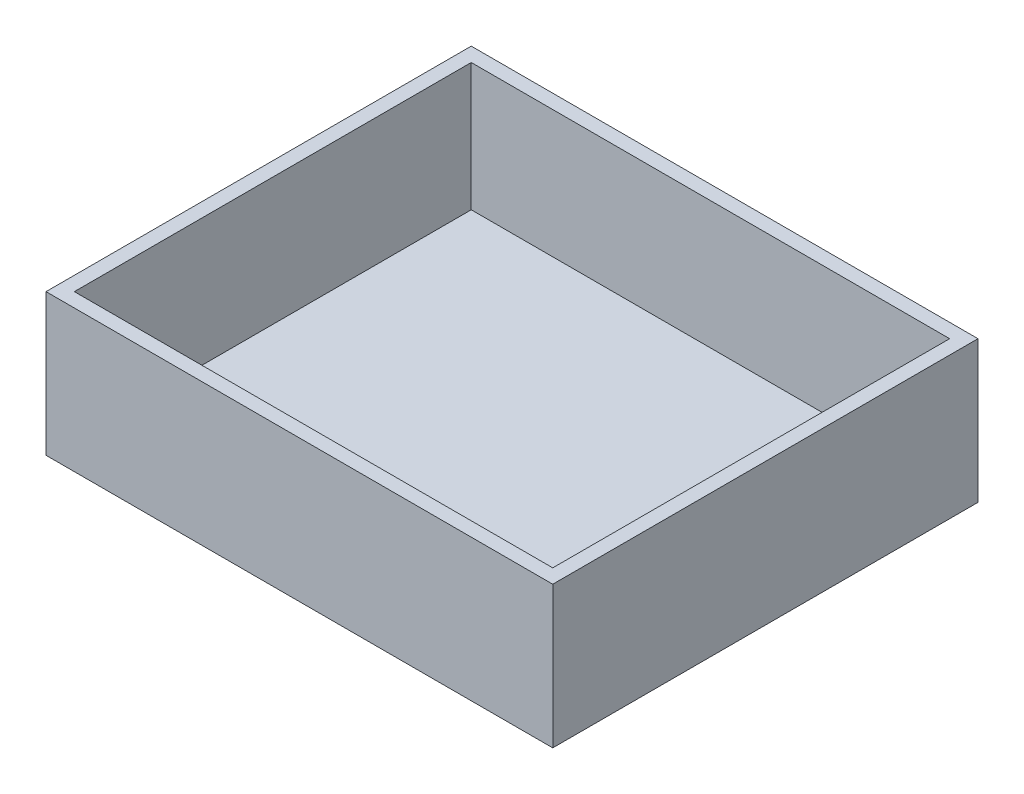
from build123d import *

# Parameters (mm, degrees)
CROQUIS1_W              = 71.5
CROQUIS1_H              = 60
SALIENTE_EXTRUIR1_DEPTH = 20
VACIADO1_T              = -2
CROQUIS3_W              = 32.700305435
CROQUIS3_H              = 4.402483211
CROQUIS3_W_2            = 29.112946205
CROQUIS3_H_2            = 4.942332104
SALIENTE_EXTRUIR2_DEPTH = 3


with BuildPart() as part:
    # Croquis1 → Saliente-Extruir1 (new body)
    with BuildSketch(Plane(origin=(0, 0, 0), x_dir=(1, 0, 0), z_dir=(0, 1, 0))):
        Rectangle(CROQUIS1_W, CROQUIS1_H)
    extrude(amount=SALIENTE_EXTRUIR1_DEPTH)

    # Vaciado1
    vaciado1_openings = [part.faces().sort_by_distance(p)[0] for p in [
        (0, 20, 0),
    ]]
    offset(amount=VACIADO1_T, openings=vaciado1_openings, kind=Kind.INTERSECTION)

    # Croquis3 → Saliente-Extruir2 (add)
    with BuildSketch(Plane.XZ):
        with Locations((-12.899847283, 21.798758394)):
            Rectangle(CROQUIS3_W, CROQUIS3_H)
        with Locations((-14.693526898, -21.528833948)):
            Rectangle(CROQUIS3_W_2, CROQUIS3_H_2)
    extrude(amount=SALIENTE_EXTRUIR2_DEPTH)


solid = part.part
